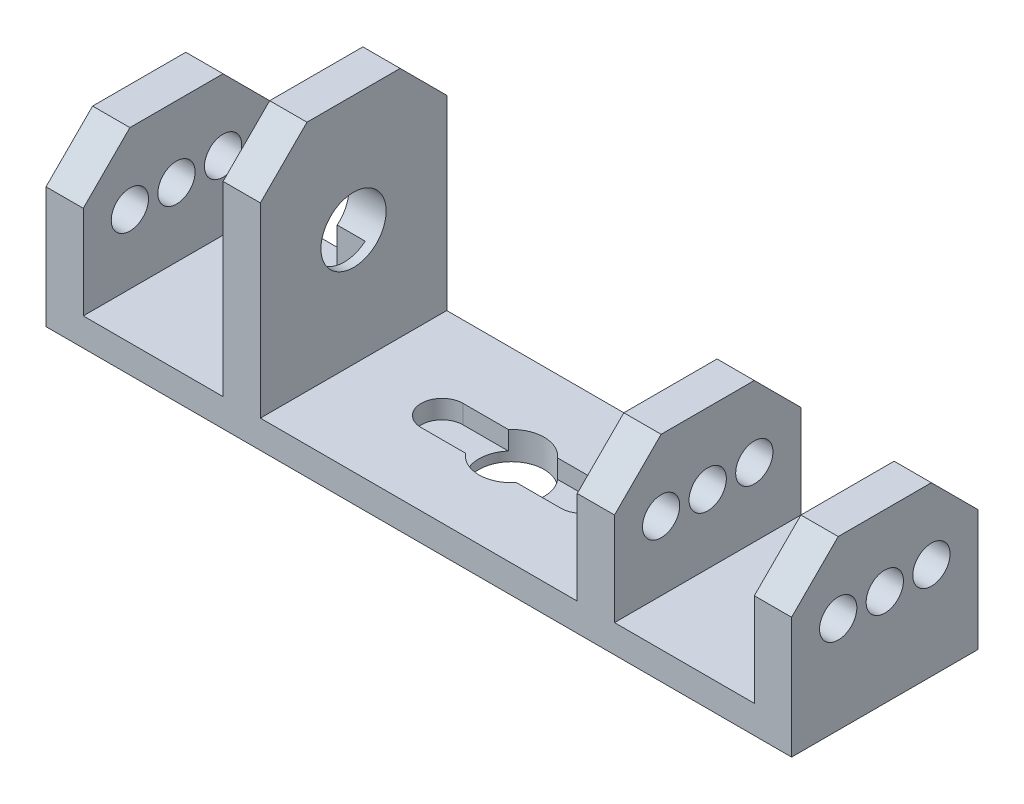
from build123d import *

# Parameters (mm, degrees)
SKETCH_1_W          = 80
SKETCH_1_H          = 20
EXTRUDE_1_DEPTH     = 3
SKETCH_2_R          = 3.5
CUT_EXTRUDE_1_DEPTH = 3
SKETCH_3_W          = 15
SKETCH_3_H          = 4.5
CUT_EXTRUDE_2_DEPTH = 2
SKETCH_5_R          = 2.25
CUT_EXTRUDE_3_DEPTH = 2
SKETCH_6_W          = 4
SKETCH_6_H          = 20
EXTRUDE_2_DEPTH     = 15
CUT_EXTRUDE_4_DEPTH = 83
SKETCH_8_R          = 2
CUT_EXTRUDE_5_DEPTH = 83
SKETCH_9_W          = 4
SKETCH_9_H          = 20
EXTRUDE_3_DEPTH     = 25
SKETCH_10_R         = 3.5
CUT_EXTRUDE_6_DEPTH = 6
SKETCH_11_W         = 4.5
SKETCH_11_H         = 15
CUT_EXTRUDE_7_DEPTH = 3
SKETCH_12_R         = 2.25
CUT_EXTRUDE_8_DEPTH = 3
CUT_EXTRUDE_9_DEPTH = 10


with BuildPart() as part:
    # 草图1 → 凸台-拉伸1 (new body)
    with BuildSketch(Plane(origin=(0, 0, 0), x_dir=(1, 0, 0), z_dir=(0, 1, 0))):
        with Locations((40, -10)):
            Rectangle(SKETCH_1_W, SKETCH_1_H)
    extrude(amount=EXTRUDE_1_DEPTH)

    # 草图2 → 切除-拉伸1 (cut)
    with BuildSketch(Plane(origin=(0, 3, 0), x_dir=(1, 0, 0), z_dir=(0, 1, 0))):
        with Locations(Location((40, -10.045477327, 0), (0, 0, 270))):
            Circle(SKETCH_2_R)
    extrude(amount=-CUT_EXTRUDE_1_DEPTH, mode=Mode.SUBTRACT)

    # 草图3 → 切除-拉伸2 (cut)
    with BuildSketch(Plane(origin=(0, 3, 0), x_dir=(1, 0, 0), z_dir=(0, 1, 0))):
        with Locations((40, -10)):
            Rectangle(SKETCH_3_W, SKETCH_3_H)
    extrude(amount=-CUT_EXTRUDE_2_DEPTH, mode=Mode.SUBTRACT)

    # 草图5 → 切除-拉伸3 (cut)
    with BuildSketch(Plane(origin=(0, 3, 0), x_dir=(1, 0, 0), z_dir=(0, 1, 0))):
        with Locations((32.5, -10)):
            Circle(SKETCH_5_R)
        with Locations((47.5, -10)):
            Circle(SKETCH_5_R)
    extrude(amount=-CUT_EXTRUDE_3_DEPTH, mode=Mode.SUBTRACT)

    # 草图6 → 凸台-拉伸2 (add)
    with BuildSketch(Plane(origin=(0, 3, 0), x_dir=(1, 0, 0), z_dir=(0, 1, 0))):
        with Locations((2, -10)):
            Rectangle(SKETCH_6_W, SKETCH_6_H)
        with Locations((78, -10)):
            Rectangle(SKETCH_6_W, SKETCH_6_H)
        with Locations((59, -10)):
            Rectangle(SKETCH_6_W, SKETCH_6_H)
    extrude(amount=EXTRUDE_2_DEPTH)

    # 草图7 → 切除-拉伸4 (cut)
    with BuildSketch(Plane(origin=(80, 0, 0), x_dir=(0, 0, -1), z_dir=(1, 0, 0))):
        Polygon((-20, 13), (-15, 18), (-20, 18), align=None)
        Polygon((0, 13), (0, 18), (-5, 18), align=None)
    extrude(amount=-CUT_EXTRUDE_4_DEPTH, mode=Mode.SUBTRACT)

    # 草图8 → 切除-拉伸5 (cut)
    with BuildSketch(Plane.ZY):
        with Locations((5, 10.386894075)):
            Circle(SKETCH_8_R)
        with Locations((10, 10.386894075)):
            Circle(SKETCH_8_R)
        with Locations((15, 10.386894075)):
            Circle(SKETCH_8_R)
    extrude(amount=-CUT_EXTRUDE_5_DEPTH, mode=Mode.SUBTRACT)

    # 草图9 → 凸台-拉伸3 (add)
    with BuildSketch(Plane(origin=(0, 3, 0), x_dir=(1, 0, 0), z_dir=(0, 1, 0))):
        with Locations((21, -10)):
            Rectangle(SKETCH_9_W, SKETCH_9_H)
    extrude(amount=EXTRUDE_3_DEPTH)

    # 草图10 → 切除-拉伸6 (cut)
    with BuildSketch(Plane.ZY.offset(-19)):
        with Locations((10, 15.5)):
            Circle(SKETCH_10_R)
    extrude(amount=-CUT_EXTRUDE_6_DEPTH, mode=Mode.SUBTRACT)

    # 草图11 → 切除-拉伸7 (cut)
    with BuildSketch(Plane.ZY.offset(-19)):
        with Locations((10, 15.4)):
            Rectangle(SKETCH_11_W, SKETCH_11_H)
    extrude(amount=-CUT_EXTRUDE_7_DEPTH, mode=Mode.SUBTRACT)

    # 草图12 → 切除-拉伸8 (cut)
    with BuildSketch(Plane.ZY.offset(-19)):
        with Locations((10, 22.9)):
            Circle(SKETCH_12_R)
        with Locations((10, 7.9)):
            Circle(SKETCH_12_R)
    extrude(amount=-CUT_EXTRUDE_8_DEPTH, mode=Mode.SUBTRACT)

    # 草图13 → 切除-拉伸9 (cut)
    with BuildSketch(Plane.ZY.offset(-19)):
        Polygon((5, 28), (0, 23), (0, 28), align=None)
        Polygon((20, 28), (15, 28), (20, 23), align=None)
    extrude(amount=-CUT_EXTRUDE_9_DEPTH, mode=Mode.SUBTRACT)


solid = part.part
